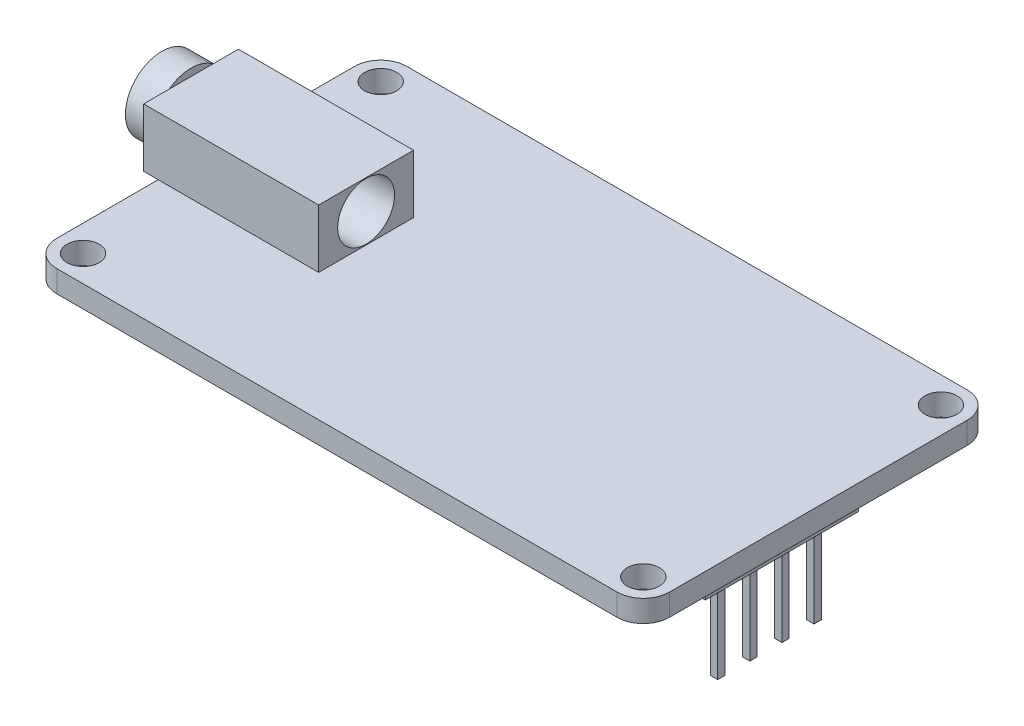
from build123d import *

# Parameters (mm, degrees)
SKETCH1_R           = 1.1
BOSS_EXTRUDE1_DEPTH = 1.5
SKETCH2_W           = 12
SKETCH2_H           = 6.5
BOSS_EXTRUDE2_DEPTH = 4
SKETCH5_R           = 2.5
BOSS_EXTRUDE3_DEPTH = 2
SKETCH6_R           = 1.95
CUT_EXTRUDE1_DEPTH  = 15.02758553
SKETCH8_W           = 2.2
SKETCH8_H           = 10.5
BOSS_EXTRUDE4_DEPTH = 2.7
SKETCH9_W           = 0.5
SKETCH9_H           = 0.5
BOSS_EXTRUDE5_DEPTH = 6
LPATTERN1_COUNT     = 4
LPATTERN1_PITCH     = 2.2


with BuildPart() as part:
    # Sketch1 → Boss-Extrude1 (new body)
    with BuildSketch(Plane(origin=(0, 0, 0), x_dir=(1, 0, 0), z_dir=(0, 1, 0))):
        with BuildLine():
            Line((-1.8, 0), (-40.2, 0))
            ThreePointArc((-40.2, 0), (-41.472792206, 0.527207794), (-42, 1.8))
            Line((-42, 1.8), (-42, 22.2))
            ThreePointArc((-42, 22.2), (-41.472792206, 23.472792206), (-40.2, 24))
            Line((-40.2, 24), (-1.8, 24))
            ThreePointArc((-1.8, 24), (-0.527207794, 23.472792206), (0, 22.2))
            Line((0, 22.2), (0, 1.8))
            ThreePointArc((0, 1.8), (-0.527207794, 0.527207794), (-1.8, 0))
        make_face()
        with Locations(Location((-40.2, 1.8, 0), (0, 0, 270))):
            Circle(SKETCH1_R, mode=Mode.SUBTRACT)
        with Locations(Location((-1.8, 1.8, 0), (0, 0, 270))):
            Circle(SKETCH1_R, mode=Mode.SUBTRACT)
        with Locations(Location((-1.8, 22.2, 0), (0, 0, 270))):
            Circle(SKETCH1_R, mode=Mode.SUBTRACT)
        with Locations(Location((-40.2, 22.2, 0), (0, 0, 270))):
            Circle(SKETCH1_R, mode=Mode.SUBTRACT)
    extrude(amount=BOSS_EXTRUDE1_DEPTH)

    # Sketch2 → Boss-Extrude2 (add)
    with BuildSketch(Plane(origin=(0, 1.5, 0), x_dir=(1, 0, 0), z_dir=(0, 1, 0))):
        with Locations((-37, 12)):
            Rectangle(SKETCH2_W, SKETCH2_H)
    extrude(amount=BOSS_EXTRUDE2_DEPTH)

    # Sketch5 → Boss-Extrude3 (add)
    with BuildSketch(Plane.ZY.offset(43)):
        with Locations(Location((-12, 3.5, 0), (0, 0, 126.869897646))):
            Circle(SKETCH5_R)
    extrude(amount=BOSS_EXTRUDE3_DEPTH)

    # Sketch6 → Cut-Extrude1 (cut)
    with BuildSketch(Plane.ZY.offset(45)):
        with Locations((-12, 3.5)):
            Circle(SKETCH6_R)
    extrude(amount=-CUT_EXTRUDE1_DEPTH, mode=Mode.SUBTRACT)

    # Sketch8 → Boss-Extrude4 (add)
    with BuildSketch(Plane.XZ):
        with Locations((-3.6, -12)):
            Rectangle(SKETCH8_W, SKETCH8_H)
    extrude(amount=BOSS_EXTRUDE4_DEPTH)

    # Sketch9 → Boss-Extrude5 (add)
    with BuildSketch(Plane.XZ.offset(2.7)):
        with Locations((-3.6, -8.7)):
            Rectangle(SKETCH9_W, SKETCH9_H)
    boss_extrude5 = extrude(amount=BOSS_EXTRUDE5_DEPTH)

    # LPattern1: Boss-Extrude5 ×4
    with Locations(*[(0, 0, -i * LPATTERN1_PITCH) for i in range(1, LPATTERN1_COUNT)]):
        add(boss_extrude5)


solid = part.part
